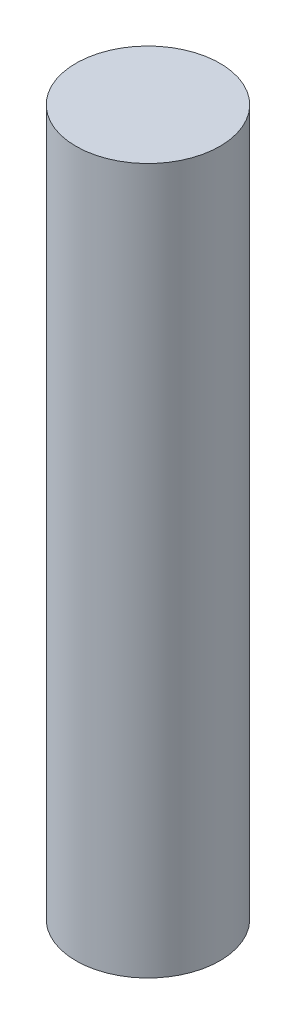
from build123d import *

# Parameters (mm, degrees)
SKETCH1_R           = 5
BOSS_EXTRUDE2_DEPTH = 49


with BuildPart() as part:
    # Sketch1 → Boss-Extrude2 (new body)
    with BuildSketch(Plane(origin=(0, 0, 0), x_dir=(1, 0, 0), z_dir=(0, 1, 0))):
        with Locations(Location((0, 0, 0), (0, 0, 270))):
            Circle(SKETCH1_R)
    extrude(amount=BOSS_EXTRUDE2_DEPTH)


solid = part.part
